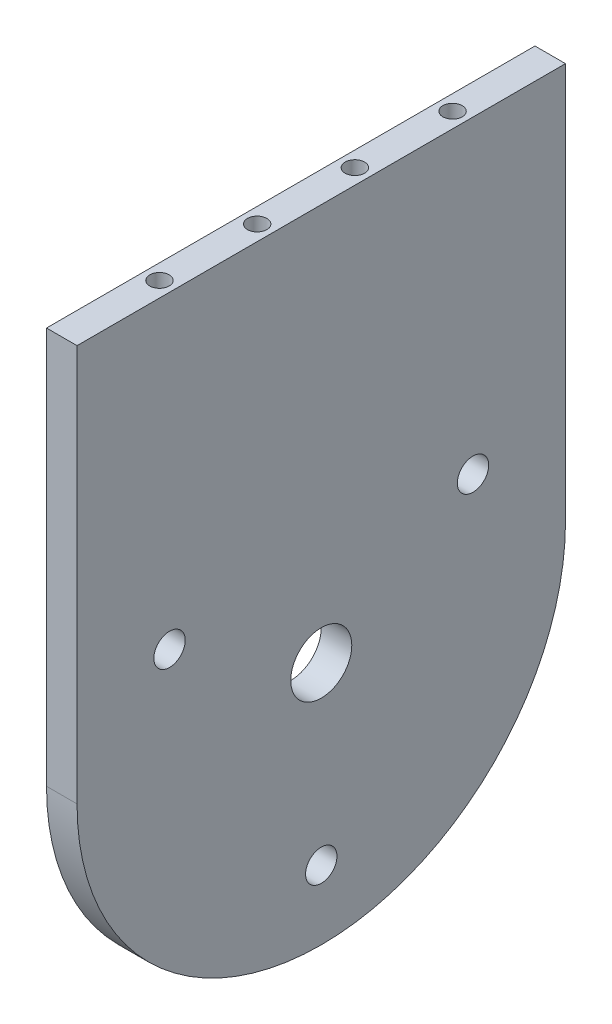
from build123d import *

# Parameters (mm, degrees)
SKETCH2_R                  = 6.35
BOSS_EXTRUDE1_DEPTH        = 3.175
F_1_4_CLEARANCE_HOLE1_D    = 6.5278
F_10_32_TAPPED_HOLE1_D     = 4.0386
F_10_32_TAPPED_HOLE1_DEPTH = 12.7
F_10_32_TAPPED_HOLE1_TIP   = 1.213317848


with BuildPart() as part:
    # Sketch2 → Boss-Extrude1 (new, symmetric)
    with BuildSketch(Plane(origin=(0, 0, 0), x_dir=(0, 0, -1), z_dir=(1, 0, 0))):
        with BuildLine():
            Line((-50.8, 0), (50.8, 0))
            Line((50.8, 0), (50.8, -82.55))
            ThreePointArc((50.8, -82.55), (0, -133.35), (-50.8, -82.55))
            Line((-50.8, -82.55), (-50.8, 0))
        make_face()
        with Locations((0, -82.55)):
            Circle(SKETCH2_R, mode=Mode.SUBTRACT)
    extrude(amount=BOSS_EXTRUDE1_DEPTH, both=True)

    # 1/4 Clearance Hole1 (through all)
    with Locations(Plane(origin=(3.175, 0, 0), x_dir=(0, 0, -1), z_dir=(1, 0, 0))):
        with Locations((-31.56136055, -64.32803999), (31.56136055, -64.32803999), (0, -118.993920019)):
            Hole(F_1_4_CLEARANCE_HOLE1_D / 2)

    # #10-32 Tapped Hole1
    with Locations(Plane(origin=(0, 0, 0), x_dir=(1, 0, 0), z_dir=(0, 1, 0))):
        with Locations((0, 30.48), (0, 10.16), (0, -10.16), (0, -30.48)):
            Hole(F_10_32_TAPPED_HOLE1_D / 2, depth=F_10_32_TAPPED_HOLE1_DEPTH)
            with Locations((0, 0, -(F_10_32_TAPPED_HOLE1_DEPTH + F_10_32_TAPPED_HOLE1_TIP / 2))):  # 118° drill point
                Cone(0, F_10_32_TAPPED_HOLE1_D / 2, F_10_32_TAPPED_HOLE1_TIP, mode=Mode.SUBTRACT)


solid = part.part
